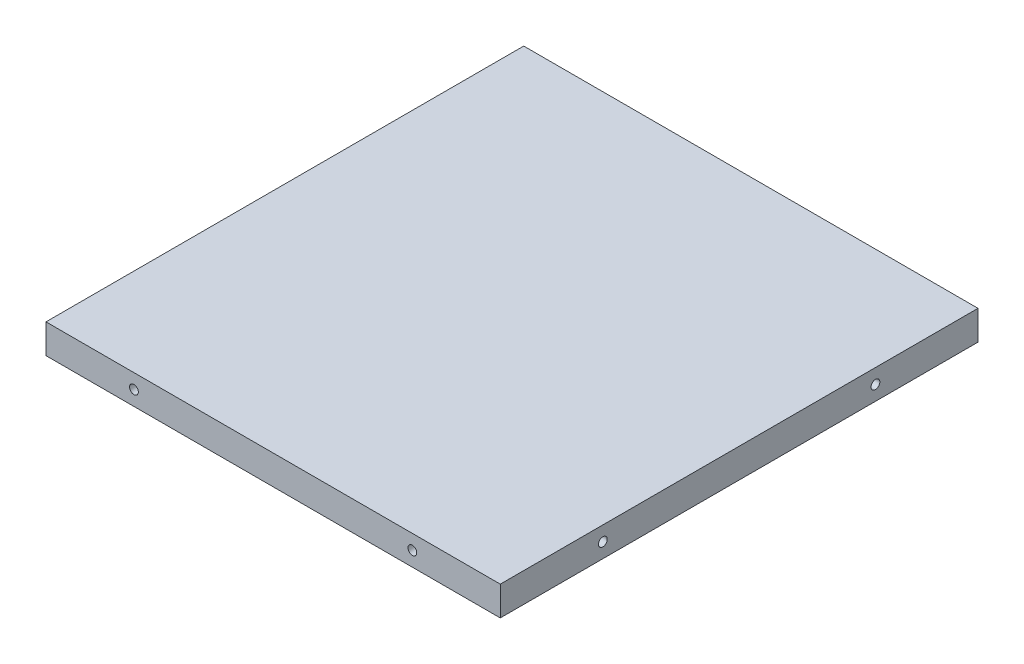
from build123d import *

# Parameters (mm, degrees)
SKETCH1_W               = 155
SKETCH1_H               = 163
BOSS_EXTRUDE1_DEPTH     = 10
SKETCH2_R               = 1.5
CUT_EXTRUDE1_DEPTH      = 20
CUT_EXTRUDE2_DEPTH      = 226.153281122
CUT_EXTRUDE2_DEPTH_BACK = 226.153281122
SKETCH3_R               = 1.5


with BuildPart() as part:
    # Sketch1 → Boss-Extrude1 (new body)
    with BuildSketch(Plane(origin=(0, 0, 0), x_dir=(1, 0, 0), z_dir=(0, 1, 0))):
        with Locations((77.5, 81.5)):
            Rectangle(SKETCH1_W, SKETCH1_H)
    extrude(amount=BOSS_EXTRUDE1_DEPTH)

    # Sketch2 → Cut-Extrude1 (cut)
    with BuildSketch(Plane(origin=(0, 0, -163), x_dir=(-1, 0, 0), z_dir=(0, 0, -1))):
        with Locations((-125, 5)):
            Circle(SKETCH2_R)
        with Locations(Location((-30, 5, 0), (0, 0, 180))):
            Circle(SKETCH2_R)
    cut_extrude1 = extrude(amount=-CUT_EXTRUDE1_DEPTH, mode=Mode.SUBTRACT)

    # Mirror1: Cut-Extrude1 across plane
    add(cut_extrude1.mirror(Plane(origin=(0, 0, -81.5), x_dir=(1, 0, 0), z_dir=(0, 0, -1))), mode=Mode.SUBTRACT)

    # Sketch3 → Cut-Extrude2 (cut, two sides: drawn at the far end of the back side and taken through both)
    with BuildSketch(Plane(origin=(155, 0, 0), x_dir=(0, 0, -1), z_dir=(1, 0, 0)).offset(-CUT_EXTRUDE2_DEPTH_BACK)):
        with Locations((35, 5)):
            Circle(SKETCH3_R)
        with Locations(Location((128, 5, 0), (0, 0, 180))):
            Circle(SKETCH3_R)
    extrude(amount=CUT_EXTRUDE2_DEPTH + CUT_EXTRUDE2_DEPTH_BACK, mode=Mode.SUBTRACT)


solid = part.part
